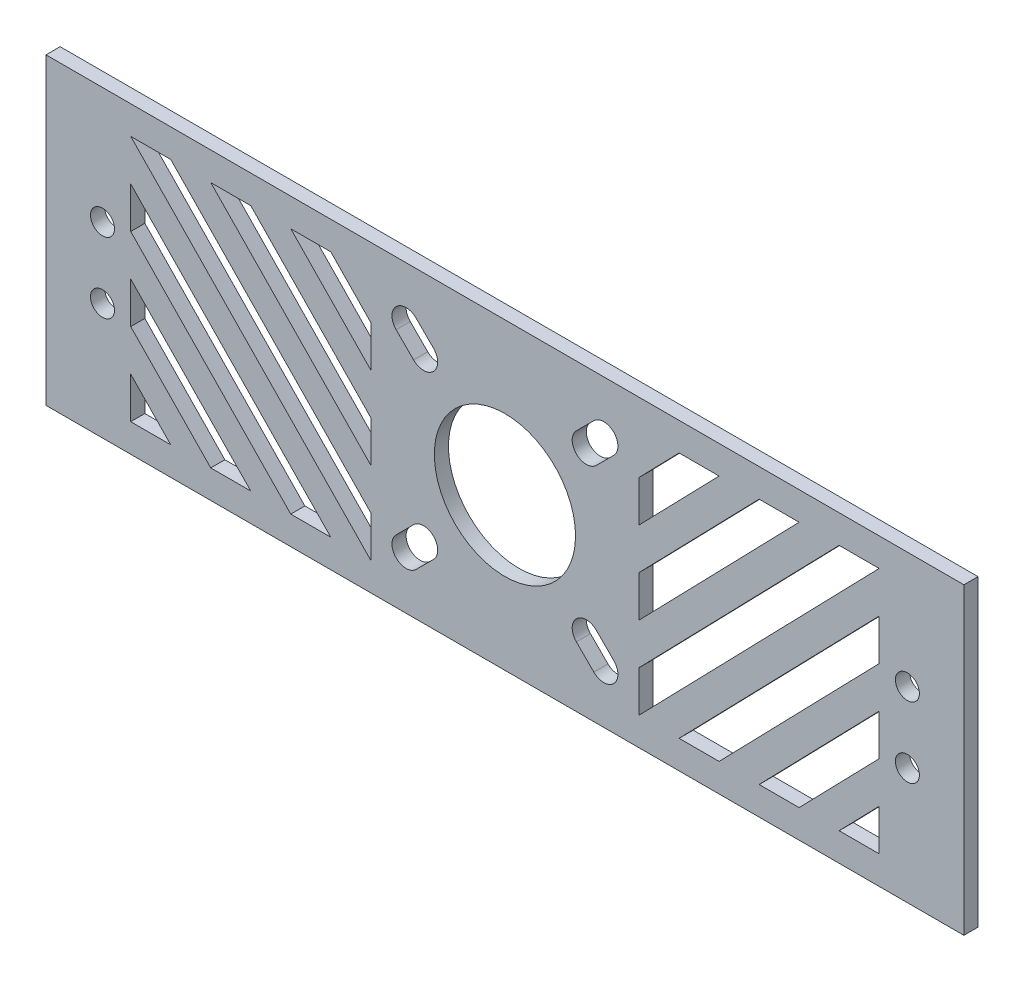
from build123d import *

# Parameters (mm, degrees)
SKETCH_1_W          = 130
SKETCH_1_H          = 43
EXTRUDE_1_DEPTH     = 2
CUT_EXTRUDE_1_DEPTH = 69.492700341
SKETCH_3_R          = 1.7
CUT_EXTRUDE_2_DEPTH = 69.492700341
SKETCH_4_R          = 10
SKETCH_4_W          = 34
SKETCH_4_H          = 35
CUT_EXTRUDE_3_DEPTH = 69.492700341
EXTRUDE_2_DEPTH     = 2


with BuildPart() as part:
    # 草图1 → 凸台-拉伸1 (new body)
    with BuildSketch(Plane.XY):
        Rectangle(SKETCH_1_W, SKETCH_1_H)
    extrude(amount=EXTRUDE_1_DEPTH)

    # 草图2 → 切除-拉伸1 (cut, through all)
    with BuildSketch(Plane.XY.offset(2)):
        with BuildLine():
            Line((-12.585786438, 15.414213562), (-10.110912703, 12.939339828))
            ThreePointArc((-10.110912703, 12.939339828), (-10.110912703, 10.110912703), (-12.939339828, 10.110912703))
            Line((-12.939339828, 10.110912703), (-15.414213562, 12.585786438))
            ThreePointArc((-15.414213562, 12.585786438), (-15.414213562, 15.414213562), (-12.585786438, 15.414213562))
        make_face()
        with BuildLine():
            Line((15.414213562, 12.585786438), (12.939339828, 10.110912703))
            ThreePointArc((12.939339828, 10.110912703), (10.110912703, 10.110912703), (10.110912703, 12.939339828))
            Line((10.110912703, 12.939339828), (12.585786438, 15.414213562))
            ThreePointArc((12.585786438, 15.414213562), (15.414213562, 15.414213562), (15.414213562, 12.585786438))
        make_face()
        with BuildLine():
            Line((12.585786438, -15.414213562), (10.110912703, -12.939339828))
            ThreePointArc((10.110912703, -12.939339828), (10.110912703, -10.110912703), (12.939339828, -10.110912703))
            Line((12.939339828, -10.110912703), (15.414213562, -12.585786438))
            ThreePointArc((15.414213562, -12.585786438), (15.414213562, -15.414213562), (12.585786438, -15.414213562))
        make_face()
        with BuildLine():
            Line((-15.414213562, -12.585786438), (-12.939339828, -10.110912703))
            ThreePointArc((-12.939339828, -10.110912703), (-10.110912703, -10.110912703), (-10.110912703, -12.939339828))
            Line((-10.110912703, -12.939339828), (-12.585786438, -15.414213562))
            ThreePointArc((-12.585786438, -15.414213562), (-15.414213562, -15.414213562), (-15.414213562, -12.585786438))
        make_face()
    extrude(amount=-CUT_EXTRUDE_1_DEPTH, mode=Mode.SUBTRACT)

    # 草图3 → 切除-拉伸2 (cut, through all)
    with BuildSketch(Plane.XY.offset(2)):
        with Locations((57, 5)):
            Circle(SKETCH_3_R)
        with Locations((57, -5)):
            Circle(SKETCH_3_R)
        with Locations(Location((-57, -5, 0), (0, 0, 180))):
            Circle(SKETCH_3_R)
        with Locations(Location((-57, 5, 0), (0, 0, 180))):
            Circle(SKETCH_3_R)
    extrude(amount=-CUT_EXTRUDE_2_DEPTH, mode=Mode.SUBTRACT)

    # 草图4 → 切除-拉伸3 (cut, through all)
    with BuildSketch(Plane.XY.offset(2)):
        Circle(SKETCH_4_R)
        with Locations((-36, 0)):
            Rectangle(SKETCH_4_W, SKETCH_4_H)
        with Locations((36, 0)):
            Rectangle(SKETCH_4_W, SKETCH_4_H)
    extrude(amount=-CUT_EXTRUDE_3_DEPTH, mode=Mode.SUBTRACT)

    # 草图6 → 凸台-拉伸2 (add, through all)
    with BuildSketch(Plane.XY.offset(2)):
        Polygon((-19, -17.5), (-53, 17.5), (-53, 11.666666667), (-24.666666667, -17.5), align=None)
        Polygon((-41.666666667, 17.5), (-47.333333333, 17.5), (-19, -11.666666667), (-19, -5.833333333), align=None)
        Polygon((-30.333333333, -17.5), (-53, 5.833333333), (-53, 0), (-36, -17.5), align=None)
        Polygon((-30.333333333, 17.5), (-36, 17.5), (-19, 0), (-19, 5.833333333), align=None)
        Polygon((-41.666666667, -17.5), (-53, -5.833333333), (-53, -11.666666667), (-47.333333333, -17.5), align=None)
        Polygon((-19, 17.5), (-24.666666667, 17.5), (-19, 11.666666667), align=None)
    extrude_2 = extrude(amount=-EXTRUDE_2_DEPTH)

    # 镜向1: 凸台-拉伸2 across plane
    add(extrude_2.mirror(Plane(origin=(0, 0, 0), x_dir=(0, 0, 1), z_dir=(1, 0, 0))))


solid = part.part
